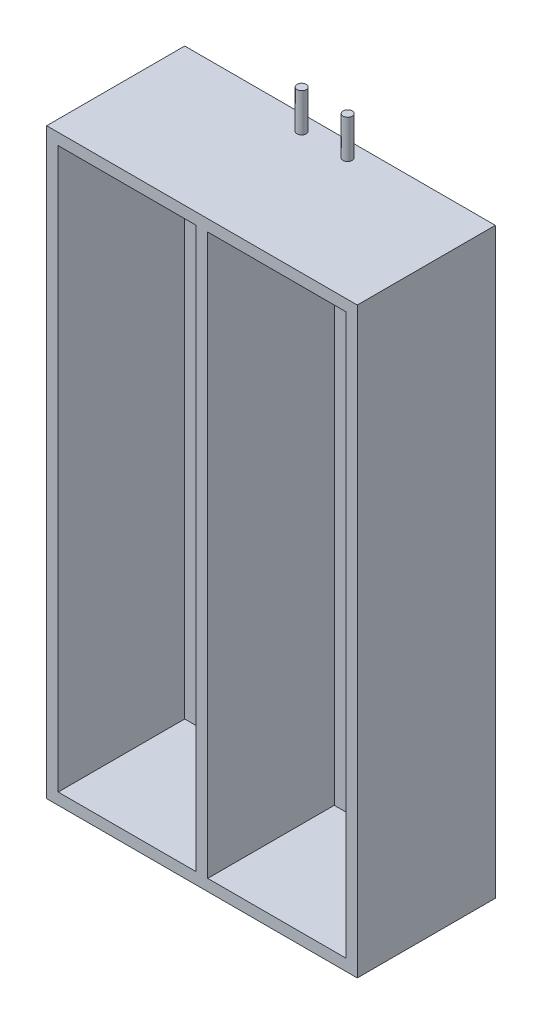
from build123d import *

# Parameters (mm, degrees)
SKETCH1_W           = 76
SKETCH1_H           = 40.5
BOSS_EXTRUDE1_DEPTH = 9
SHELL1_T            = -1.5
SKETCH2_W           = 1.5
SKETCH2_H           = 73
BOSS_EXTRUDE2_DEPTH = 16.5
SKETCH3_R           = 0.6
BOSS_EXTRUDE3_DEPTH = 5


with BuildPart() as part:
    # Sketch1 → Boss-Extrude1 (new, symmetric)
    with BuildSketch(Plane(origin=(0, 0, 0), x_dir=(0, 1, 0), z_dir=(0, 0, 1))):
        Rectangle(SKETCH1_W, SKETCH1_H)
    extrude(amount=BOSS_EXTRUDE1_DEPTH, both=True)

    # Shell1
    shell1_openings = [part.faces().sort_by_distance(p)[0] for p in [
        (0, 0, 9),
    ]]
    offset(amount=SHELL1_T, openings=shell1_openings, kind=Kind.INTERSECTION)

    # Sketch2 → Boss-Extrude2 (add)
    with BuildSketch(Plane.XY.offset(-7.5)):
        Rectangle(SKETCH2_W, SKETCH2_H)
    extrude(amount=BOSS_EXTRUDE2_DEPTH)

    # Sketch3 → Boss-Extrude3 (add)
    with BuildSketch(Plane(origin=(0, 38, 0), x_dir=(-1, 0, 0), z_dir=(0, 1, 0))):
        with Locations(Location((3, -7, 0), (0, 0, 270))):
            Circle(SKETCH3_R)
        with Locations(Location((-3, -7, 0), (0, 0, 270))):
            Circle(SKETCH3_R)
    extrude(amount=BOSS_EXTRUDE3_DEPTH)


solid = part.part
